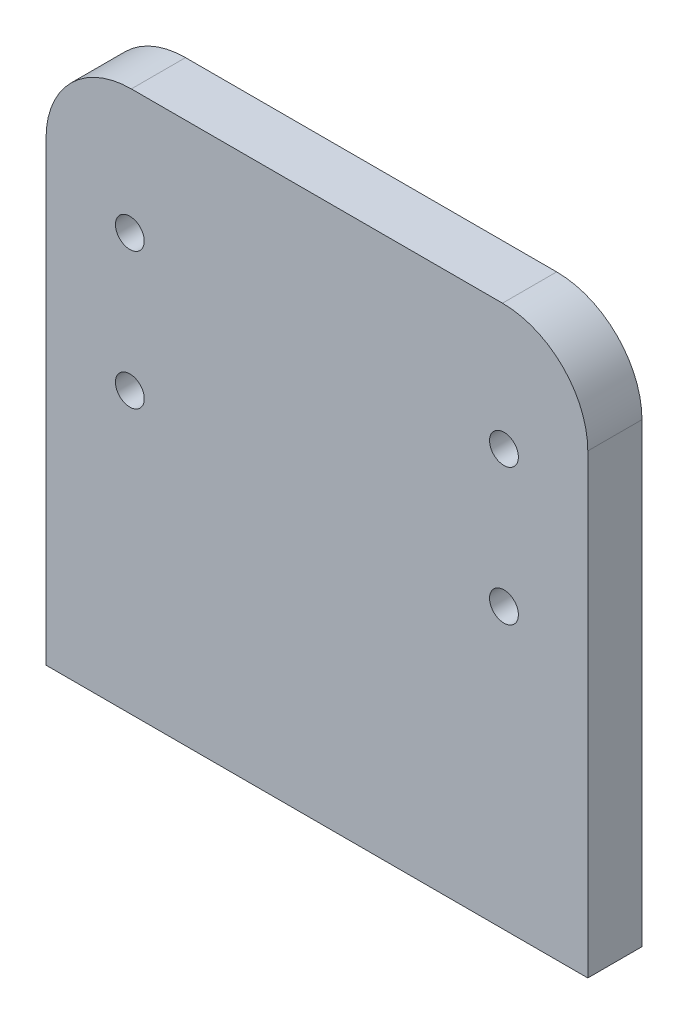
from build123d import *

# Parameters (mm, degrees)
SALIENTE_EXTRUIR1_DEPTH                              = 6.35
REFRENTADO_PARA_TORNILLO_CON_CABEZA_HUEC_D           = 6.7564
REFRENTADO_PARA_TORNILLO_CON_CABEZA_HUEC_CBORE_D     = 11.1125
REFRENTADO_PARA_TORNILLO_CON_CABEZA_HUEC_CBORE_DEPTH = 6.35


with BuildPart() as part:
    # Croquis1 → Saliente-Extruir1 (new, symmetric)
    with BuildSketch(Plane.XY):
        with BuildLine():
            Line((43.5, 63.5), (-43.5, 63.5))
            ThreePointArc((-43.5, 63.5), (-57.642135624, 57.642135624), (-63.5, 43.5))
            Line((-63.5, 43.5), (-63.5, -63.5))
            Line((-63.5, -63.5), (63.5, -63.5))
            Line((63.5, -63.5), (63.5, 43.5))
            ThreePointArc((63.5, 43.5), (57.642135624, 57.642135624), (43.5, 63.5))
        make_face()
    extrude(amount=SALIENTE_EXTRUIR1_DEPTH, both=True)

    # Refrentado para tornillo con cabeza hueca de 1/41 (through all)
    with Locations(Plane(origin=(0, 0, -6.35), x_dir=(-1, 0, 0), z_dir=(0, 0, -1))):
        with Locations((43.85, 34.1), (43.85, 2.1), (-43.85, 2.1), (-43.85, 34.1)):
            CounterBoreHole(REFRENTADO_PARA_TORNILLO_CON_CABEZA_HUEC_D / 2, REFRENTADO_PARA_TORNILLO_CON_CABEZA_HUEC_CBORE_D / 2, REFRENTADO_PARA_TORNILLO_CON_CABEZA_HUEC_CBORE_DEPTH)


solid = part.part
